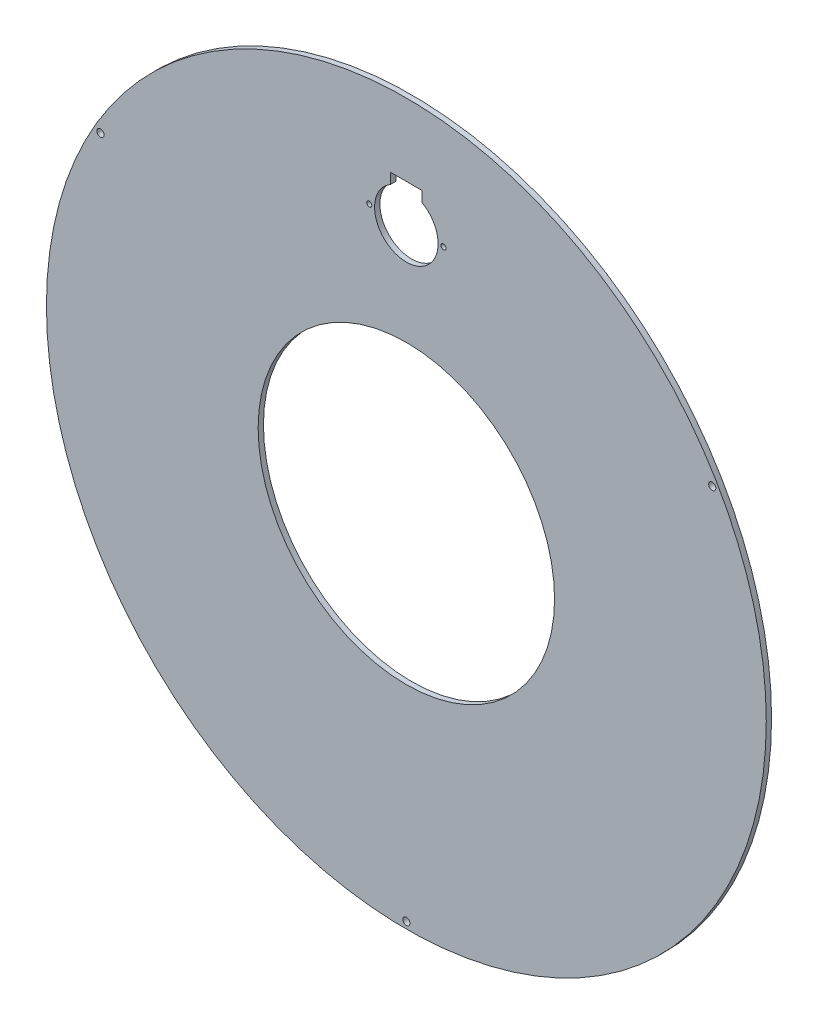
from build123d import *

# Parameters (mm, degrees)
SCHIZZO1_R                   = 170
SCHIZZO1_R_2                 = 70
ESTRUSIONE_ESTRUSIONE1_DEPTH = 2.5
TAGLIO_ESTRUSIONE1_DEPTH     = 2.5
FORO_PER_VITE_M2_1_D         = 2.4
FORO_PER_VITE_M3_1_D         = 3.4
RIPETIZIONECIRCOLARE1_COUNT  = 3


with BuildPart() as part:
    # Schizzo1 → Estrusione-Estrusione1 (new body)
    with BuildSketch(Plane.XY):
        Circle(SCHIZZO1_R)
        Circle(SCHIZZO1_R_2, mode=Mode.SUBTRACT)
    extrude(amount=ESTRUSIONE_ESTRUSIONE1_DEPTH)

    # Schizzo3 → Taglio-Estrusione1 (cut)
    with BuildSketch(Plane.XY.offset(2.5)):
        with BuildLine():
            Line((7.5, 135.840381057), (-7.5, 135.840381057))
            Line((-7.5, 135.840381057), (-7.5, 130.840381057))
            ThreePointArc((-7.5, 130.840381057), (0, 102.85), (7.5, 130.840381057))
            Line((7.5, 130.840381057), (7.5, 135.840381057))
        make_face()
    extrude(amount=-TAGLIO_ESTRUSIONE1_DEPTH, mode=Mode.SUBTRACT)

    # Foro per Vite M2-1 (through all)
    with Locations(Plane.XY.offset(2.5)):
        with Locations((17.511664312, 117.848267331), (-17.511664312, 117.848267331)):
            Hole(FORO_PER_VITE_M2_1_D / 2)

    # Foro per Vite M3-1 (through all)
    with Locations(Plane.XY.offset(2.5)):
        with Locations((0, -166.830362559)):
            foro_per_vite_m3_1 = Hole(FORO_PER_VITE_M3_1_D / 2)

    # RipetizioneCircolare1: Foro per Vite M3-1 ×3 about axis
    ripetizionecircolare1_axis = Axis((0, 0, 0), (0, 0, 1))
    for i in range(1, RIPETIZIONECIRCOLARE1_COUNT):
        add(foro_per_vite_m3_1.rotate(ripetizionecircolare1_axis, i * 360 / RIPETIZIONECIRCOLARE1_COUNT), mode=Mode.SUBTRACT)


solid = part.part
